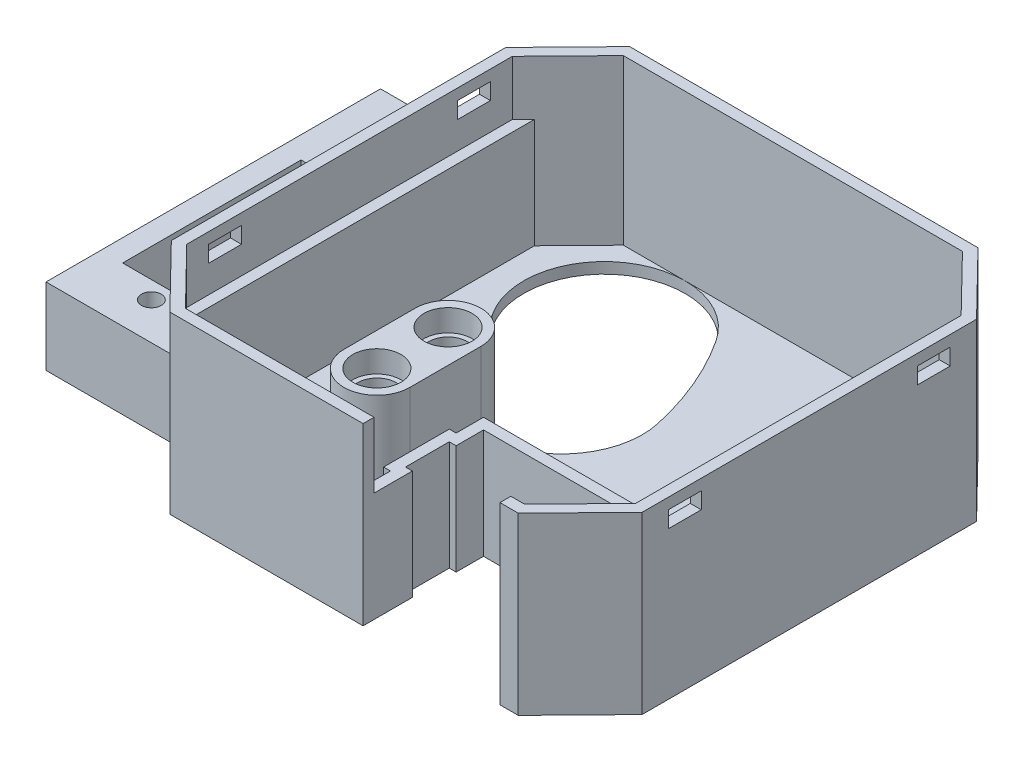
from build123d import *

# Parameters (mm, degrees)
OUTER_SHELL_EXTRUDE_DEPTH      = 16
BOTTOM_START                   = 1
BOTTOM_DEPTH                   = 34.047760572
CLIPS_EXTRUDE_DEPTH            = 51.457903246
CLIPS_EXTRUDE_DEPTH_BACK       = 51.457903246
CLIPS_W                        = 3
CLIPS_H                        = 1.5
PCB_SUPPORT_EXTRUDE_DEPTH      = 10
LED_SUPPORT_EXTRUDE_DEPTH      = 10
LEDS_EXTRUDE_DEPTH             = 35.047760572
LEDS_EXTRUDE_DEPTH_BACK        = 35.047760572
LED_HOLES_R                    = 1.75
KNX_PLUG_EXTRUDE_DEPTH         = 35.047760572
KNX_PLUG_SUPPORT_EXTRUDE_DEPTH = 9
SERVO_SHELL_W                  = 11.45
SERVO_SHELL_H                  = 30.553981132
SERVO_SHELL_W_2                = 8.45
SERVO_SHELL_H_2                = 16.3
SERVO_SHELL_EXTRUDE_DEPTH      = 7
ROTOR_CUT_EXTRUDE_DEPTH        = 1
SKETCH14_R                     = 0.9
CUT_EXTRUDE11_DEPTH            = 5
SKETCH15_W                     = 8.45
SKETCH15_H                     = 2
CUT_EXTRUDE12_DEPTH            = 3
SKETCH16_R                     = 2.2
CUT_EXTRUDE13_DEPTH            = 2


with BuildPart() as part:
    # Outer-Shell → Outer-Shell-Extrude (new body)
    with BuildSketch(Plane(origin=(0, 0, 0), x_dir=(1, 0, 0), z_dir=(0, 1, 0))):
        Polygon((-21.5, 15.276990566), (-15.910083809, 21), (15.910083809, 21), (21.5, 15.276990566), (21.5, -15.276990566), (15.910083809, -21), (-15.910083809, -21), (-21.5, -15.276990566), align=None)
    extrude(amount=OUTER_SHELL_EXTRUDE_DEPTH)

    # PCB-Outline → Bottom (cut, through all)
    with BuildSketch(Plane(origin=(0, 0, 0), x_dir=(1, 0, 0), z_dir=(0, 1, 0)).offset(BOTTOM_START)):
        Polygon((-15.488962048, 20), (-20.5, 14.869651621), (-20.5, -14.869651621), (-15.488962048, -20), (15.488962048, -20), (20.5, -14.869651621), (20.5, 14.869651621), (15.488962048, 20), align=None)
    extrude(amount=BOTTOM_DEPTH, mode=Mode.SUBTRACT)

    # Clips → Clips-Extrude (cut, two sides: drawn at the far end of the back side and taken through both)
    with BuildSketch(Plane.ZY.offset(21.5).offset(-CLIPS_EXTRUDE_DEPTH_BACK)):
        with Locations((-11.369651621, 14.25)):
            Rectangle(CLIPS_W, CLIPS_H)
        with Locations((11.369651621, 14.25)):
            Rectangle(CLIPS_W, CLIPS_H)
    extrude(amount=CLIPS_EXTRUDE_DEPTH + CLIPS_EXTRUDE_DEPTH_BACK, mode=Mode.SUBTRACT)

    # PCB-Support → PCB-Support-Extrude (add)
    with BuildSketch(Plane(origin=(0, 1, 0), x_dir=(1, 0, 0), z_dir=(0, 1, 0))):
        Polygon((-19.5, 15.893461145), (-20.5, 14.869651621), (-20.5, -14.869651621), (-19.5, -15.893461145), align=None)
    extrude(amount=PCB_SUPPORT_EXTRUDE_DEPTH)

    # LED-Support → LED-Support-Extrude (add)
    with BuildSketch(Plane(origin=(0, 1, 0), x_dir=(1, 0, 0), z_dir=(0, 1, 0))):
        with BuildLine():
            Line((-10.00959418, -11), (-10.00959418, -4.5))
            ThreePointArc((-10.00959418, -4.5), (-7, -1.49040582), (-3.99040582, -4.5))
            Line((-3.99040582, -4.5), (-3.99040582, -11))
            ThreePointArc((-3.99040582, -11), (-7, -14.00959418), (-10.00959418, -11))
        make_face()
    extrude(amount=LED_SUPPORT_EXTRUDE_DEPTH)

    # led-holes → LEDs-Extrude (cut, two sides: drawn at the far end of the back side and taken through both)
    with BuildSketch(Plane(origin=(0, 0, 0), x_dir=(1, 0, 0), z_dir=(0, 1, 0)).offset(-LEDS_EXTRUDE_DEPTH_BACK)):
        with Locations(Location((-7, -11, 0), (0, 0, 270))):
            Circle(LED_HOLES_R)
        with Locations(Location((-7, -4.5, 0), (0, 0, 270))):
            Circle(LED_HOLES_R)
    extrude(amount=LEDS_EXTRUDE_DEPTH + LEDS_EXTRUDE_DEPTH_BACK, mode=Mode.SUBTRACT)

    # KNX-Plug → KNX-Plug-Extrude (cut, through all)
    with BuildSketch(Plane(origin=(0, 16, 0), x_dir=(1, 0, 0), z_dir=(0, 1, 0))):
        Polygon((14.238962048, -10), (14.238962048, -21), (1.738962048, -21), (1.738962048, -16.5), (1.111583994, -16.5), (1.111583994, -12.5), (1.738962048, -12.5), (1.738962048, -10), align=None)
    extrude(amount=-KNX_PLUG_EXTRUDE_DEPTH, mode=Mode.SUBTRACT)

    # KNX-Plug-Support → KNX-Plug-Support-Extrude (add)
    with BuildSketch(Plane(origin=(0, 1, 0), x_dir=(1, 0, 0), z_dir=(0, 1, 0))):
        Polygon((0.738962048, -17.5), (0.738962048, -20), (1.738962048, -20), (1.738962048, -16.5), (1.111583994, -16.5), (1.111583994, -12.5), (1.738962048, -12.5), (1.738962048, -10), (14.238962048, -10), (14.238962048, -20), (15.238962048, -20), (15.238962048, -9), (0.738962048, -9), (0.738962048, -11.5), (0.111583994, -11.5), (0.111583994, -17.5), align=None)
    extrude(amount=KNX_PLUG_SUPPORT_EXTRUDE_DEPTH)

    # Rotor → Rotor-Cut-Extrude (cut)
    with BuildSketch(Plane(origin=(0, 0, 0), x_dir=(1, 0, 0), z_dir=(0, 1, 0))):
        with BuildLine():
            ThreePointArc((0.197085573, 7.469985253), (-1.327867915, 12.25384793), (-3.695115483, 16.681823111))
            ThreePointArc((-3.695115483, 16.681823111), (-13.904106465, 18.785997776), (-16.008281129, 8.577006794))
            ThreePointArc((-16.008281129, 8.577006794), (-14.906706926, 6.516494283), (-14.197085573, 4.290373201))
            ThreePointArc((-14.197085573, 4.290373201), (-5.410193974, -1.316906346), (0.197085573, 7.469985253))
        make_face()
    extrude(amount=ROTOR_CUT_EXTRUDE_DEPTH, mode=Mode.SUBTRACT)

    # Sketch16 → Cut-Extrude13 (cut)
    with BuildSketch(Plane(origin=(0, 11, 0), x_dir=(1, 0, 0), z_dir=(0, 1, 0))):
        with Locations(Location((-7, -11, 0), (0, 0, 270))):
            Circle(SKETCH16_R)
        with Locations(Location((-7, -4.5, 0), (0, 0, 270))):
            Circle(SKETCH16_R)
    extrude(amount=-CUT_EXTRUDE13_DEPTH, mode=Mode.SUBTRACT)


with BuildPart() as body_2:
    # Servo-Shell → Servo-Shell-Extrude (new body)
    with BuildSketch(Plane(origin=(0, 0, 0), x_dir=(1, 0, 0), z_dir=(0, 1, 0))):
        with Locations((-27.225, 0)):
            Rectangle(SERVO_SHELL_W, SERVO_SHELL_H)
        with Locations((-26.725, -2.126990566)):
            Rectangle(SERVO_SHELL_W_2, SERVO_SHELL_H_2, mode=Mode.SUBTRACT)
    extrude(amount=SERVO_SHELL_EXTRUDE_DEPTH)

    # Sketch14 → Cut-Extrude11 (cut)
    with BuildSketch(Plane(origin=(0, 7, 0), x_dir=(1, 0, 0), z_dir=(0, 1, 0))):
        with Locations(Location((-26.725, -11.876990566, 0), (0, 0, 270))):
            Circle(SKETCH14_R)
        with Locations(Location((-26.725, 7.623009434, 0), (0, 0, 90))):
            Circle(SKETCH14_R)
    extrude(amount=-CUT_EXTRUDE11_DEPTH, mode=Mode.SUBTRACT)

    # Sketch15 → Cut-Extrude12 (cut)
    with BuildSketch(Plane.XZ):
        with Locations((-26.725, 13.276990566)):
            Rectangle(SKETCH15_W, SKETCH15_H)
        with Locations((-26.725, -13.276990566)):
            Rectangle(SKETCH15_W, SKETCH15_H)
    extrude(amount=-CUT_EXTRUDE12_DEPTH, mode=Mode.SUBTRACT)


solid = Compound([part.part, body_2.part])
